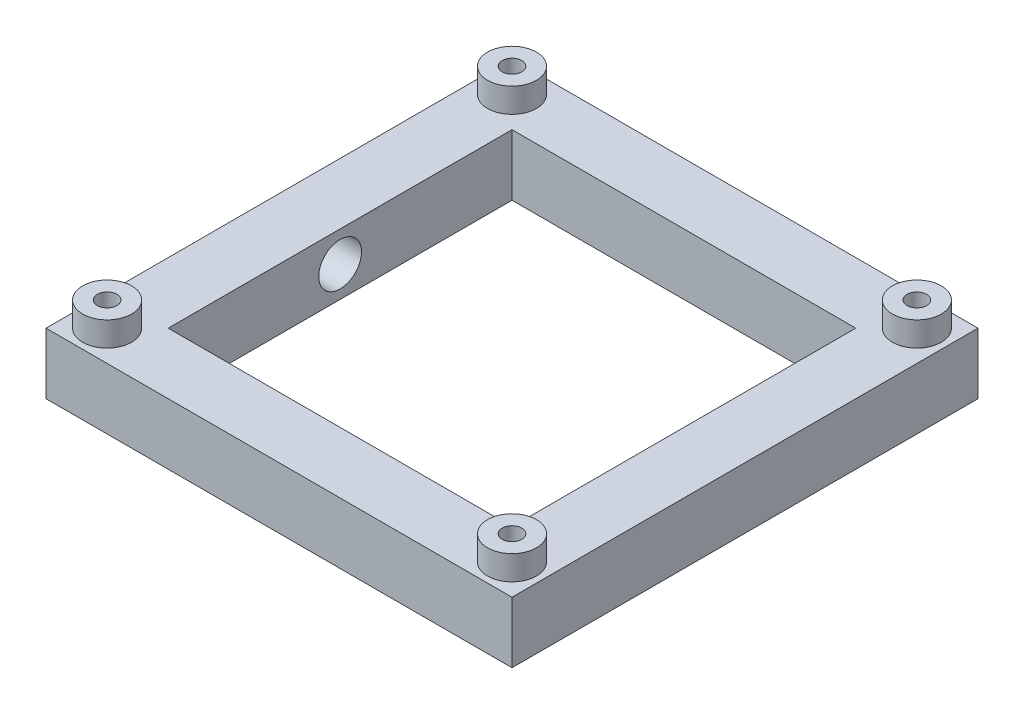
from build123d import *

# Parameters (mm, degrees)
SKETCH1_W           = 76.25
SKETCH1_H           = 76.25
SKETCH1_R           = 4
SKETCH1_W_2         = 56.25
SKETCH1_H_2         = 56.25
SKETCH1_R_2         = 1.6
BOSS_EXTRUDE1_DEPTH = 10
SKETCH2_R           = 3.5
CUT_EXTRUDE1_DEPTH  = 10
BOSS_EXTRUDE2_START = 10
SKETCH1_3_R         = 4
SKETCH1_3_R_2       = 1.6
BOSS_EXTRUDE2_DEPTH = 4


with BuildPart() as part:
    # Sketch1 → Boss-Extrude1 (new body)
    # profile 1 of 5: a face of its own
    with BuildSketch(Plane(origin=(0, 0, 0), x_dir=(1, 0, 0), z_dir=(0, 1, 0))):
        with Locations((28.125, -28.125)):
            Rectangle(SKETCH1_W, SKETCH1_H)
        with Locations((-5, 5)):
            Circle(SKETCH1_R, mode=Mode.SUBTRACT)
        with Locations((-5, -61.25)):
            Circle(SKETCH1_R, mode=Mode.SUBTRACT)
        with Locations((61.25, -61.25)):
            Circle(SKETCH1_R, mode=Mode.SUBTRACT)
        with Locations((61.25, 5)):
            Circle(SKETCH1_R, mode=Mode.SUBTRACT)
        with Locations((28.125, -28.125)):
            Rectangle(SKETCH1_W_2, SKETCH1_H_2, mode=Mode.SUBTRACT)
    # profile 2 of 5: a face of its own
    with BuildSketch(Plane(origin=(0, 0, 0), x_dir=(1, 0, 0), z_dir=(0, 1, 0))):
        with Locations((61.25, 5)):
            Circle(SKETCH1_R)
        with Locations(Location((61.25, 5, 0), (0, 0, 270))):
            Circle(SKETCH1_R_2, mode=Mode.SUBTRACT)
    # profile 3 of 5: a face of its own
    with BuildSketch(Plane(origin=(0, 0, 0), x_dir=(1, 0, 0), z_dir=(0, 1, 0))):
        with Locations((61.25, -61.25)):
            Circle(SKETCH1_R)
        with Locations(Location((61.25, -61.25, 0), (0, 0, 270))):
            Circle(SKETCH1_R_2, mode=Mode.SUBTRACT)
    # profile 4 of 5: a face of its own
    with BuildSketch(Plane(origin=(0, 0, 0), x_dir=(1, 0, 0), z_dir=(0, 1, 0))):
        with Locations((-5, -61.25)):
            Circle(SKETCH1_R)
        with Locations(Location((-5, -61.25, 0), (0, 0, 270))):
            Circle(SKETCH1_R_2, mode=Mode.SUBTRACT)
    # profile 5 of 5: a face of its own
    with BuildSketch(Plane(origin=(0, 0, 0), x_dir=(1, 0, 0), z_dir=(0, 1, 0))):
        with Locations((-5, 5)):
            Circle(SKETCH1_R)
        with Locations(Location((-5, 5, 0), (0, 0, 270))):
            Circle(SKETCH1_R_2, mode=Mode.SUBTRACT)
    extrude(amount=BOSS_EXTRUDE1_DEPTH)

    # Sketch2 → Cut-Extrude1 (cut)
    with BuildSketch(Plane(origin=(0, 0, 0), x_dir=(0, 0, -1), z_dir=(1, 0, 0))):
        with Locations((-28.125, 5)):
            Circle(SKETCH2_R)
    extrude(amount=-CUT_EXTRUDE1_DEPTH, mode=Mode.SUBTRACT)

    # Sketch1<3> → Boss-Extrude2 (add)
    # profile 1 of 4: a face of its own
    with BuildSketch(Plane(origin=(0, 0, 0), x_dir=(1, 0, 0), z_dir=(0, 1, 0)).offset(BOSS_EXTRUDE2_START)):
        with Locations(Location((-5, 5, 0), (0, 0, 270))):
            Circle(SKETCH1_3_R)
        with Locations(Location((-5, 5, 0), (0, 0, 270))):
            Circle(SKETCH1_3_R_2, mode=Mode.SUBTRACT)
    # profile 2 of 4: a face of its own
    with BuildSketch(Plane(origin=(0, 0, 0), x_dir=(1, 0, 0), z_dir=(0, 1, 0)).offset(BOSS_EXTRUDE2_START)):
        with Locations(Location((-5, -61.25, 0), (0, 0, 270))):
            Circle(SKETCH1_3_R)
        with Locations(Location((-5, -61.25, 0), (0, 0, 270))):
            Circle(SKETCH1_3_R_2, mode=Mode.SUBTRACT)
    # profile 3 of 4: a face of its own
    with BuildSketch(Plane(origin=(0, 0, 0), x_dir=(1, 0, 0), z_dir=(0, 1, 0)).offset(BOSS_EXTRUDE2_START)):
        with Locations(Location((61.25, -61.25, 0), (0, 0, 270))):
            Circle(SKETCH1_3_R)
        with Locations(Location((61.25, -61.25, 0), (0, 0, 270))):
            Circle(SKETCH1_3_R_2, mode=Mode.SUBTRACT)
    # profile 4 of 4: a face of its own
    with BuildSketch(Plane(origin=(0, 0, 0), x_dir=(1, 0, 0), z_dir=(0, 1, 0)).offset(BOSS_EXTRUDE2_START)):
        with Locations(Location((61.25, 5, 0), (0, 0, 270))):
            Circle(SKETCH1_3_R)
        with Locations(Location((61.25, 5, 0), (0, 0, 270))):
            Circle(SKETCH1_3_R_2, mode=Mode.SUBTRACT)
    extrude(amount=BOSS_EXTRUDE2_DEPTH)


solid = part.part
